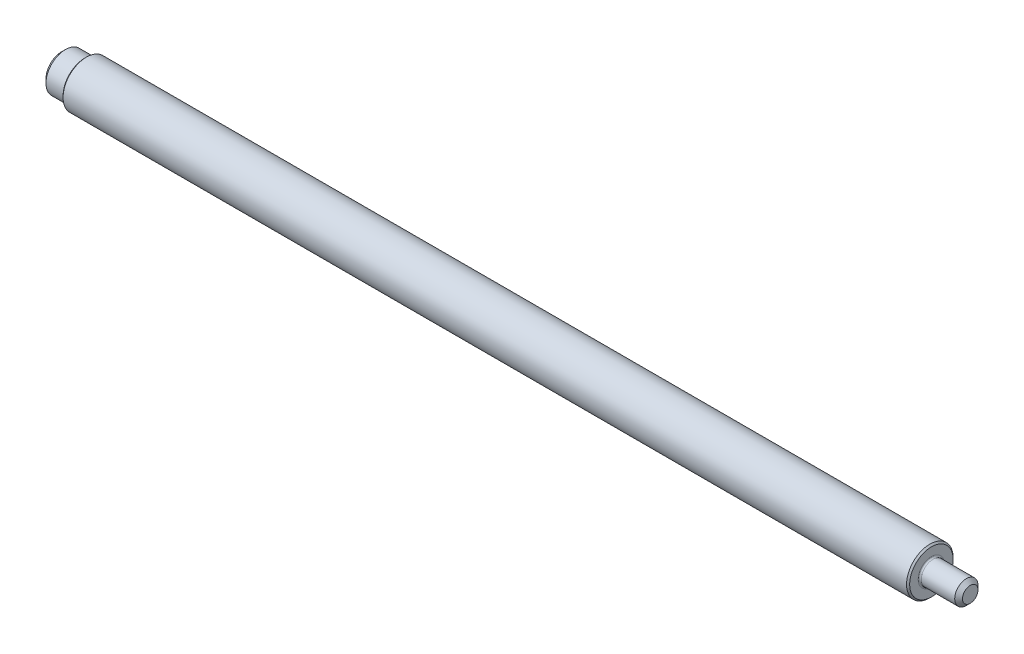
from build123d import *

# Parameters (mm, degrees)
CHAMFER1_SIZE = 0.2
CHAMFER2_SIZE = 0.2
CHAMFER3_SIZE = 0.5
CHAMFER4_SIZE = 0.5
FILLET2_R     = 0.2


with BuildPart() as part:
    # Sketch1 → Revolve1 (revolve)
    with BuildSketch(Plane.XY):
        Polygon((0, 0), (117, 0), (117, 1.5), (112, 1.5), (112, 3), (3, 3), (3, 2.5), (0, 2.5), align=None)
    revolve(axis=Axis((0, 0, 0), (1, 0, 0)))

    # Chamfer1
    chamfer1_edges = [part.edges().sort_by_distance(p)[0] for p in [
        (112, -3, 0),
    ]]
    chamfer(chamfer1_edges, length=CHAMFER1_SIZE)

    # Chamfer2
    chamfer2_edges = [part.edges().sort_by_distance(p)[0] for p in [
        (3, -3, 0),
    ]]
    chamfer(chamfer2_edges, length=CHAMFER2_SIZE)

    # Chamfer3
    chamfer3_edges = [part.edges().sort_by_distance(p)[0] for p in [
        (0, -2.5, 0),
    ]]
    chamfer(chamfer3_edges, length=CHAMFER3_SIZE)

    # Chamfer4
    chamfer4_edges = [part.edges().sort_by_distance(p)[0] for p in [
        (117, -1.5, 0),
    ]]
    chamfer(chamfer4_edges, length=CHAMFER4_SIZE)

    # Fillet2
    fillet2_edges = [part.edges().sort_by_distance(p)[0] for p in [
        (112, -1.5, 0),
    ]]
    fillet(fillet2_edges, radius=FILLET2_R)


solid = part.part
